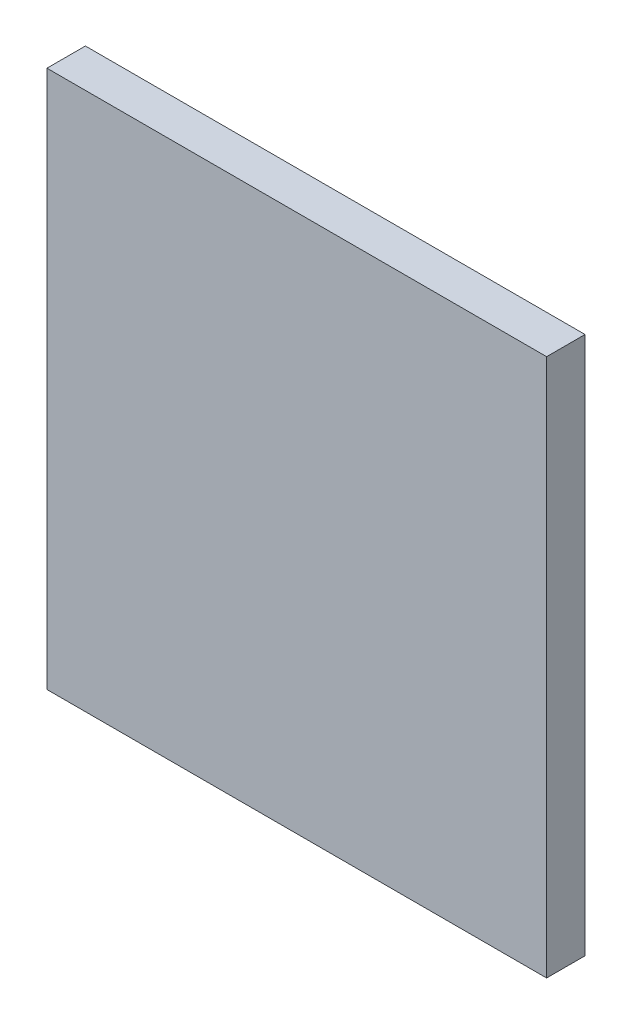
from build123d import *

# Parameters (mm, degrees)
CROQUIS1_W              = 65
CROQUIS1_H              = 70
SALIENTE_EXTRUIR1_DEPTH = 5


with BuildPart() as part:
    # Croquis1 → Saliente-Extruir1 (new body)
    with BuildSketch(Plane.XY):
        with Locations((3.261582543, -11.143617021)):
            Rectangle(CROQUIS1_W, CROQUIS1_H)
    extrude(amount=SALIENTE_EXTRUIR1_DEPTH)


solid = part.part
